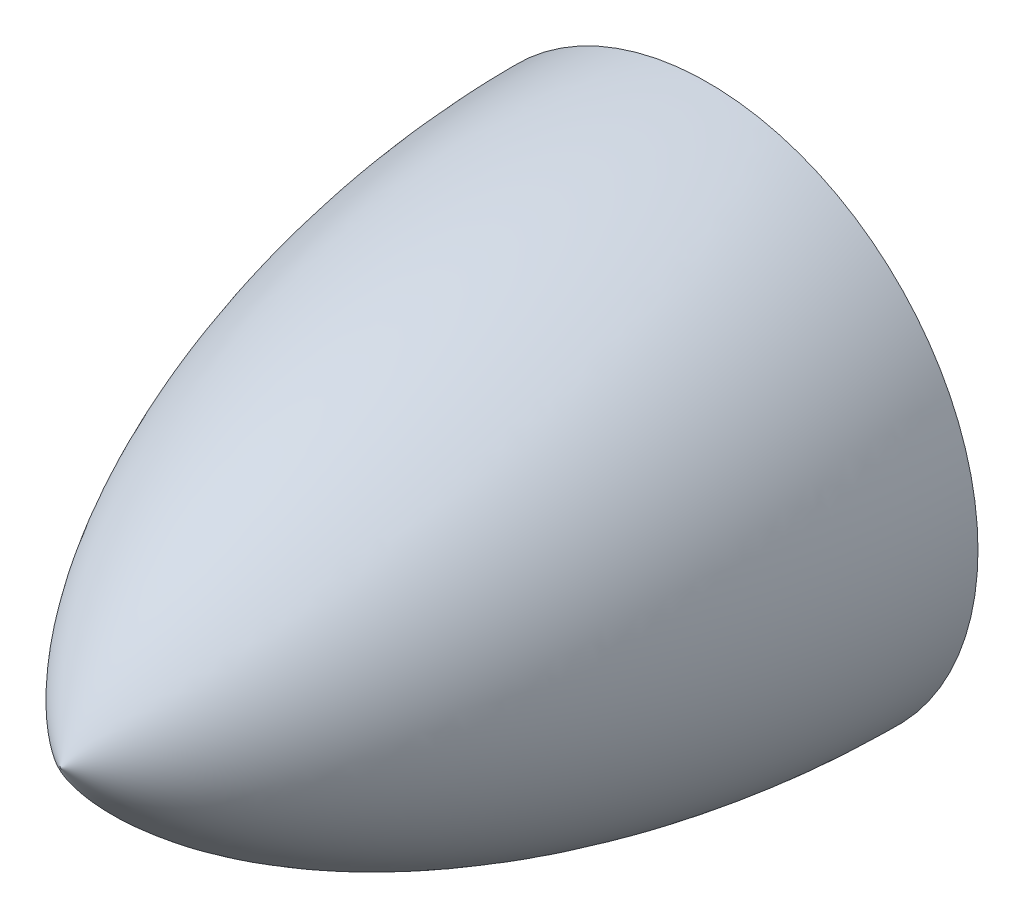
from build123d import *


with BuildPart() as part:
    # Sketch1 → Revolve1 (revolve)
    with BuildSketch(Plane(origin=(0, 0, 0), x_dir=(1, 0, 0), z_dir=(0, 1, 0))):
        with BuildLine():
            Line((63.5, 0), (0, 0))
            Line((0, 0), (0, -152.4))
            add(Edge.make_bspline(
                [(63.5, 0), (63.5, -63.53360944), (37.764301179, -130.596770549), (0, -152.4)],
                knots=[0, 0, 0, 0, 1, 1, 1, 1], degree=3))
        make_face()
    revolve(axis=Axis((0, 0, 0), (0, 0, 1)))


solid = part.part
